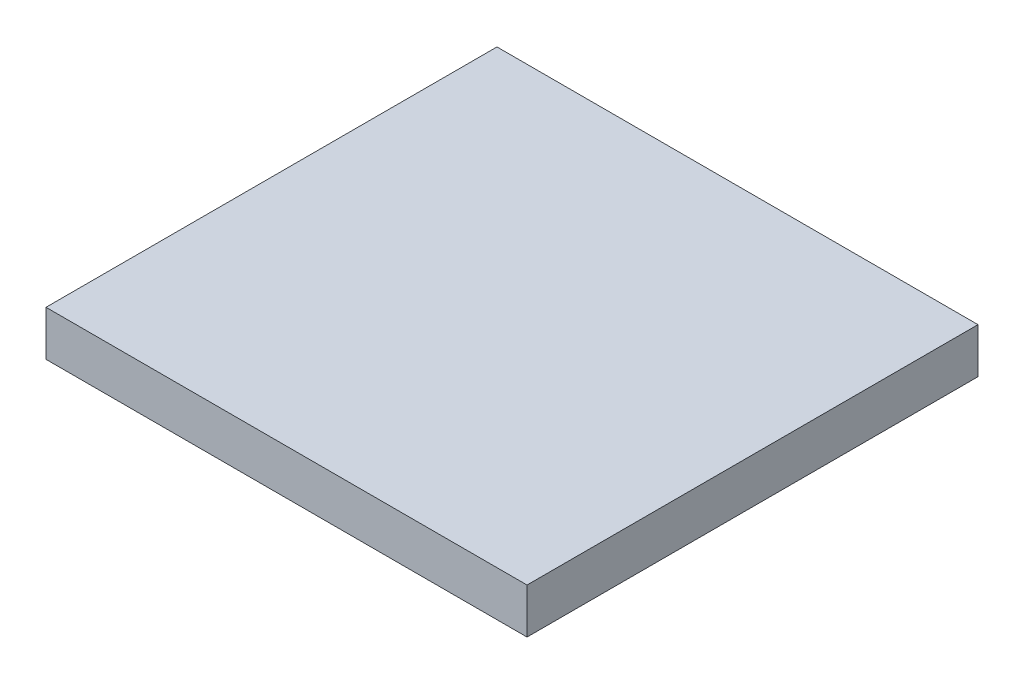
from build123d import *

# Parameters (mm, degrees)
SKETCH2_W           = 160
SKETCH2_H           = 150
BOSS_EXTRUDE1_DEPTH = 15


with BuildPart() as part:
    # Sketch2 → Boss-Extrude1 (new body)
    with BuildSketch(Plane(origin=(0, 0, 0), x_dir=(1, 0, 0), z_dir=(0, 1, 0))):
        Rectangle(SKETCH2_W, SKETCH2_H)
    extrude(amount=BOSS_EXTRUDE1_DEPTH)


solid = part.part
